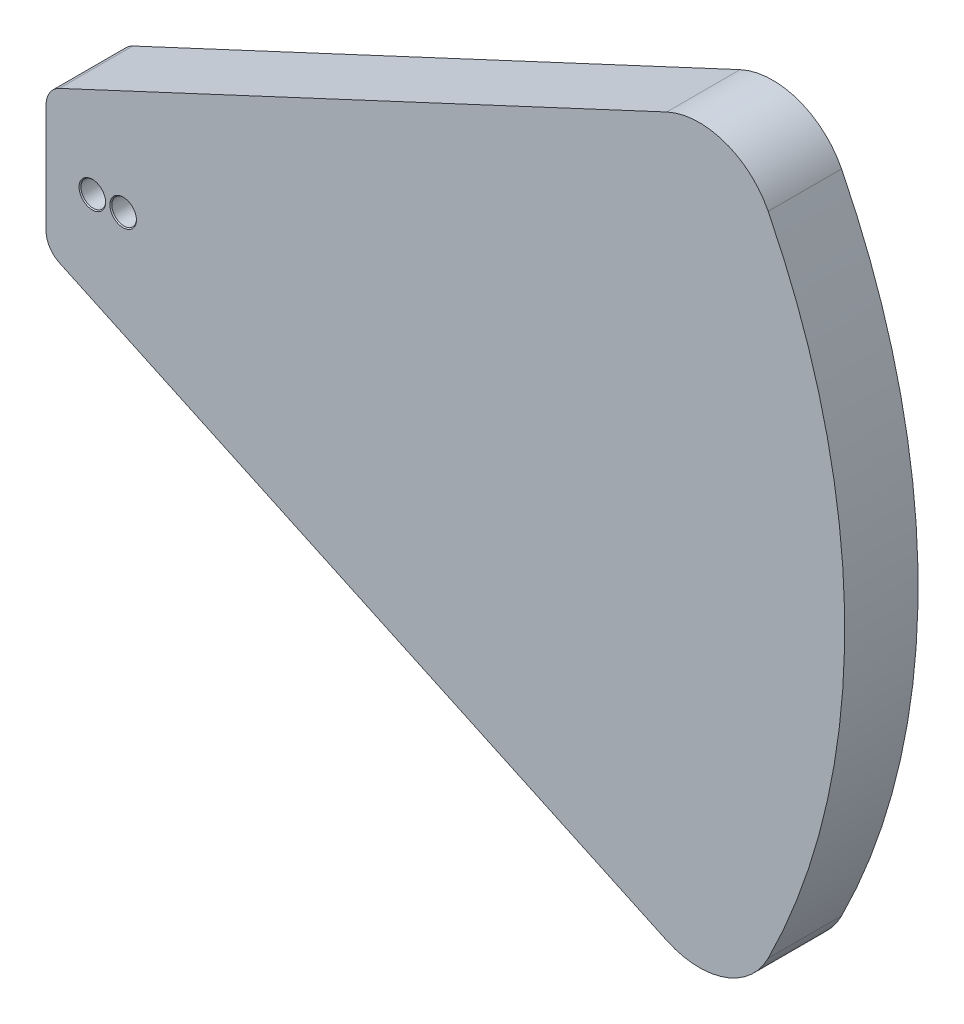
from build123d import *

# Parameters (mm, degrees)
BOSS_EXTRUDE1_DEPTH            = 9.525
CUT_EXTRUDE2_DEPTH             = 4
M3_CLEARANCE_HOLE1_D           = 3.2
M3_CLEARANCE_HOLE1_CSINK_D     = 3.45
M3_CLEARANCE_HOLE1_CSINK_ANGLE = 90
FILLET1_R                      = 1
FILLET2_R                      = 3
FILLET3_R                      = 10


with BuildPart() as part:
    # Sketch2 → Boss-Extrude1 (new body)
    with BuildSketch(Plane(origin=(0, 0, 0), x_dir=(0, 1, 0), z_dir=(0, 0, 1))):
        with BuildLine():
            Line((-9, 10), (9, 10))
            Line((9, 10), (50.45475081, -78.9))
            ThreePointArc((50.45475081, -78.9), (0, -93.653039883), (-50.45475081, -78.9))
            Line((-50.45475081, -78.9), (-9, 10))
        make_face()
    extrude(amount=BOSS_EXTRUDE1_DEPTH)

    # Sketch3 → Cut-Extrude2 (cut)
    with BuildSketch(Plane(origin=(0, 0, 0), x_dir=(1, 0, 0), z_dir=(0, 0, -1))):
        with BuildLine():
            Line((-10, -4.5), (-10, 4.5))
            Line((-10, 4.5), (0, 4.5))
            ThreePointArc((0, 4.5), (4.5, 0), (0, -4.5))
            Line((0, -4.5), (-10, -4.5))
        make_face()
    extrude(amount=-CUT_EXTRUDE2_DEPTH, mode=Mode.SUBTRACT)

    # M3 Clearance Hole1 (through all)
    with Locations(Plane(origin=(0, 0, 9.525), x_dir=(0, -1, 0), z_dir=(0, 0, 1))):
        with Locations((0, 0), (0, -4)):
            CounterSinkHole(M3_CLEARANCE_HOLE1_D / 2, M3_CLEARANCE_HOLE1_CSINK_D / 2, counter_sink_angle=M3_CLEARANCE_HOLE1_CSINK_ANGLE)

    # Fillet1
    fillet1_edges = [part.edges().sort_by_distance(p)[0] for p in [
        (-10, 4.5, 2),
        (-10, -4.5, 2),
    ]]
    fillet(fillet1_edges, radius=FILLET1_R)

    # Fillet2
    fillet2_edges = [part.edges().sort_by_distance(p)[0] for p in [
        (-10, -9, 4.7625),
        (-10, 9, 4.7625),
    ]]
    fillet(fillet2_edges, radius=FILLET2_R)

    # Fillet3
    fillet3_edges = [part.edges().sort_by_distance(p)[0] for p in [
        (78.9, 50.45475081, 4.7625),
        (78.9, -50.45475081, 4.7625),
    ]]
    fillet(fillet3_edges, radius=FILLET3_R)


solid = part.part
